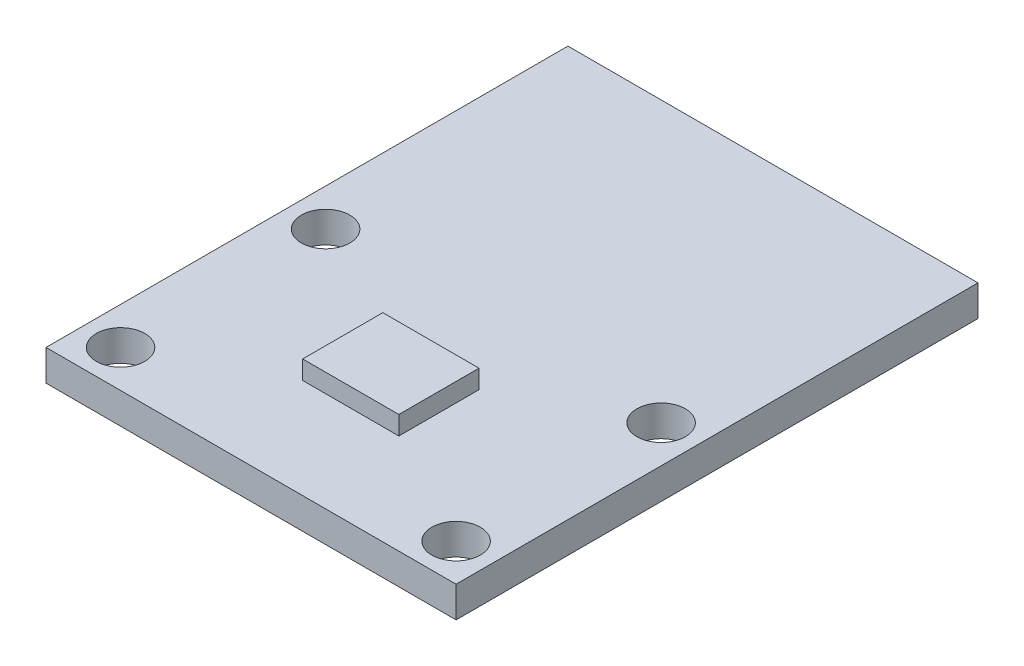
from build123d import *

# Parameters (mm, degrees)
SKETCH1_W           = 22
SKETCH1_H           = 28
SKETCH1_R           = 1.3
BOSS_EXTRUDE1_DEPTH = 0.83
SKETCH2_W           = 5.16
SKETCH2_H           = 4.3
BOSS_EXTRUDE2_DEPTH = 1


with BuildPart() as part:
    # Sketch1 → Boss-Extrude1 (new, symmetric)
    with BuildSketch(Plane(origin=(0, 0, 0), x_dir=(1, 0, 0), z_dir=(0, 1, 0))):
        Rectangle(SKETCH1_W, SKETCH1_H)
        with Locations(Location((-9, -1, 0), (0, 0, 90))):
            Circle(SKETCH1_R, mode=Mode.SUBTRACT)
        with Locations(Location((9, -1, 0), (0, 0, 90))):
            Circle(SKETCH1_R, mode=Mode.SUBTRACT)
        with Locations(Location((-9, -12, 0), (0, 0, 90))):
            Circle(SKETCH1_R, mode=Mode.SUBTRACT)
        with Locations(Location((9, -12, 0), (0, 0, 90))):
            Circle(SKETCH1_R, mode=Mode.SUBTRACT)
    extrude(amount=BOSS_EXTRUDE1_DEPTH, both=True)

    # Sketch2 → Boss-Extrude2 (add)
    with BuildSketch(Plane(origin=(0, 0.83, 0), x_dir=(1, 0, 0), z_dir=(0, 1, 0))):
        with Locations((0, -6.5)):
            Rectangle(SKETCH2_W, SKETCH2_H)
    extrude(amount=BOSS_EXTRUDE2_DEPTH)


solid = part.part
